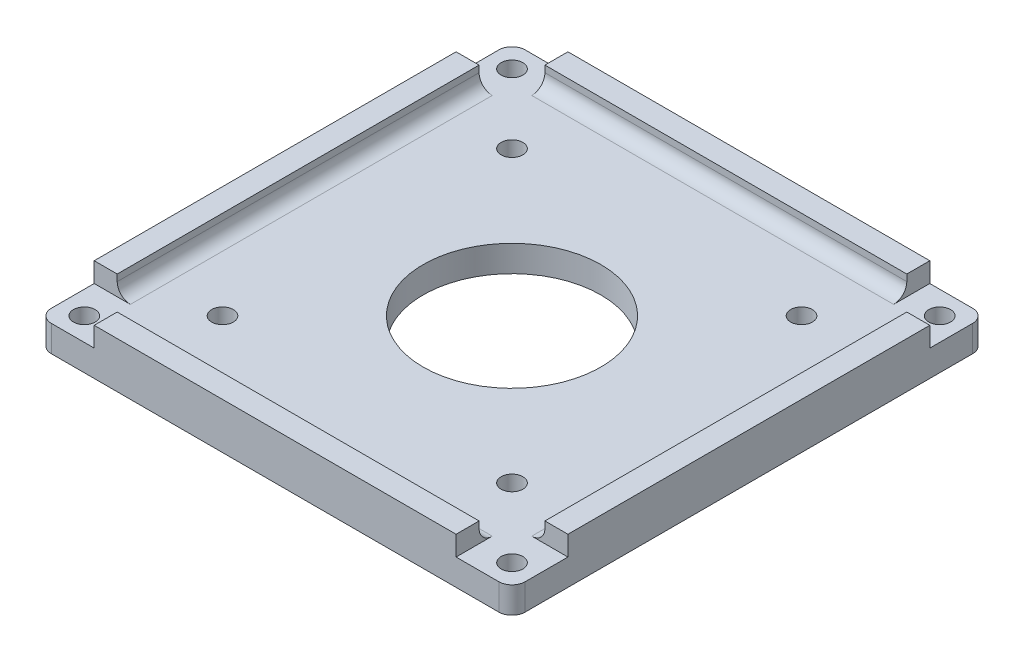
from build123d import *

# Parameters (mm, degrees)
SKETCH_1_W          = 72
SKETCH_1_H          = 72
SKETCH_1_R          = 13.5
EXTRUDE_1_DEPTH     = 4
SKETCH_2_R          = 1.65
CUT_EXTRUDE_5_DEPTH = 4
FILLET_1_R          = 2
SKETCH_3_W          = 3.5
SKETCH_3_H          = 55
SKETCH_3_W_2        = 55
SKETCH_3_H_2        = 3.5
EXTRUDE_2_DEPTH     = 3
FILLET_2_R          = 2


with BuildPart() as part:
    # 草图1 → 凸台-拉伸1 (new body)
    with BuildSketch(Plane(origin=(0, 0, 0), x_dir=(1, 0, 0), z_dir=(0, 1, 0))):
        Rectangle(SKETCH_1_W, SKETCH_1_H)
        with Locations(Location((0, 0, 0), (0, 0, 270))):
            Circle(SKETCH_1_R, mode=Mode.SUBTRACT)
    extrude(amount=EXTRUDE_1_DEPTH)

    # 草图2 → 切除-拉伸5 (cut)
    with BuildSketch(Plane(origin=(0, 0, 0), x_dir=(1, 0, 0), z_dir=(0, 1, 0))):
        with Locations(Location((-22, 22, 0), (0, 0, 270))):
            Circle(SKETCH_2_R)
        with Locations(Location((22, 22, 0), (0, 0, 270))):
            Circle(SKETCH_2_R)
        with Locations(Location((22, -22, 0), (0, 0, 270))):
            Circle(SKETCH_2_R)
        with Locations(Location((-22, -22, 0), (0, 0, 270))):
            Circle(SKETCH_2_R)
        with Locations(Location((-32.5, 32.5, 0), (0, 0, 270))):
            Circle(SKETCH_2_R)
        with Locations(Location((32.5, 32.5, 0), (0, 0, 270))):
            Circle(SKETCH_2_R)
        with Locations(Location((32.5, -32.5, 0), (0, 0, 270))):
            Circle(SKETCH_2_R)
        with Locations(Location((-32.5, -32.5, 0), (0, 0, 270))):
            Circle(SKETCH_2_R)
    extrude(amount=CUT_EXTRUDE_5_DEPTH, mode=Mode.SUBTRACT)

    # 圆角1
    fillet_1_edges = [part.edges().sort_by_distance(p)[0] for p in [
        (36, 2, 36),
        (-36, 2, 36),
        (-36, 2, -36),
        (36, 2, -36),
    ]]
    fillet(fillet_1_edges, radius=FILLET_1_R)

    # 草图3 → 凸台-拉伸2 (add)
    with BuildSketch(Plane(origin=(0, 4, 0), x_dir=(1, 0, 0), z_dir=(0, 1, 0))):
        with Locations((-34.25, 0)):
            Rectangle(SKETCH_3_W, SKETCH_3_H)
        with Locations((0, 34.25)):
            Rectangle(SKETCH_3_W_2, SKETCH_3_H_2)
        with Locations((34.25, 0)):
            Rectangle(SKETCH_3_W, SKETCH_3_H)
        with Locations((0, -34.25)):
            Rectangle(SKETCH_3_W_2, SKETCH_3_H_2)
    extrude(amount=EXTRUDE_2_DEPTH)

    # 圆角2
    fillet_2_edges = [part.edges().sort_by_distance(p)[0] for p in [
        (32.5, 4, 0),
        (0, 4, 32.5),
        (-32.5, 4, 0),
        (0, 4, -32.5),
    ]]
    fillet(fillet_2_edges, radius=FILLET_2_R)


solid = part.part
